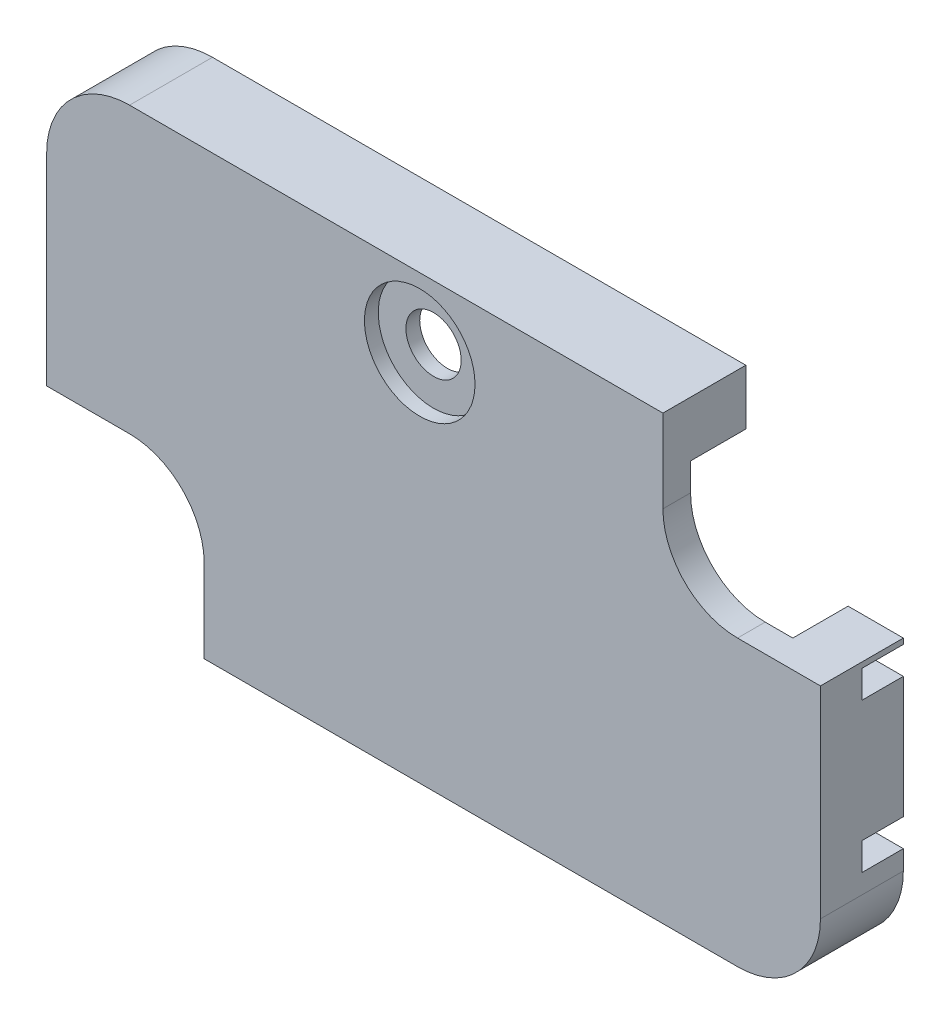
from build123d import *

# Parameters (mm, degrees)
DODANIE_WYCI_GNI_CIE1_DEPTH = 3
WYTNIJ_WYCI_GNI_CIE1_DEPTH  = 2
WYTNIJ_WYCI_GNI_CIE2_REACH  = 31.275
SZKIC3_W                    = 1.5
SZKIC3_H                    = 1
WYTNIJ_WYCI_GNI_CIE3_REACH  = 23.471
SZKIC4_W                    = 1
SZKIC4_H                    = 1.5
SZKIC5_R                    = 2
WYTNIJ_WYCI_GNI_CIE4_DEPTH  = 0.5
WYTNIJ_WYCI_GNI_CIE5_REACH  = 18.317
SZKIC6_R                    = 1


with BuildPart() as part:
    # Szkic1 → Dodanie-wyciągnięcie1 (new body)
    with BuildSketch(Plane.XY):
        with BuildLine():
            Line((-11, 8), (8.3, 8))
            Line((8.3, 8), (8.3, 5))
            ThreePointArc((8.3, 5), (9.090811691, 3.090811691), (11, 2.3))
            Line((11, 2.3), (14, 2.3))
            Line((14, 2.3), (14, -5))
            ThreePointArc((14, -5), (13.121320344, -7.121320344), (11, -8))
            Line((11, -8), (-8.3, -8))
            Line((-8.3, -8), (-8.3, -5))
            ThreePointArc((-8.3, -5), (-9.090811691, -3.090811691), (-11, -2.3))
            Line((-11, -2.3), (-14, -2.3))
            Line((-14, -2.3), (-14, 5))
            ThreePointArc((-14, 5), (-13.121320344, 7.121320344), (-11, 8))
        make_face()
    extrude(amount=DODANIE_WYCI_GNI_CIE1_DEPTH)

    # Szkic2 → Wytnij-wyciągnięcie1 (cut)
    with BuildSketch(Plane(origin=(0, 0, 0), x_dir=(-1, 0, 0), z_dir=(0, 0, -1))):
        with BuildLine():
            Line((11, 7), (-7.3, 7))
            ThreePointArc((-7.3, 7), (-8.007106781, 6.707106781), (-8.3, 6))
            Line((-8.3, 6), (-8.3, 5))
            ThreePointArc((-8.3, 5), (-9.090811691, 3.090811691), (-11, 2.3))
            Line((-11, 2.3), (-12, 2.3))
            ThreePointArc((-12, 2.3), (-12.707106781, 2.007106781), (-13, 1.3))
            Line((-13, 1.3), (-13, -5))
            ThreePointArc((-13, -5), (-12.414213562, -6.414213562), (-11, -7))
            Line((-11, -7), (7.3, -7))
            ThreePointArc((7.3, -7), (8.007106781, -6.707106781), (8.3, -6))
            Line((8.3, -6), (8.3, -5))
            ThreePointArc((8.3, -5), (9.090811691, -3.090811691), (11, -2.3))
            Line((11, -2.3), (12, -2.3))
            ThreePointArc((12, -2.3), (12.707106781, -2.007106781), (13, -1.3))
            Line((13, -1.3), (13, 5))
            ThreePointArc((13, 5), (12.414213562, 6.414213562), (11, 7))
        make_face()
    extrude(amount=-WYTNIJ_WYCI_GNI_CIE1_DEPTH, mode=Mode.SUBTRACT)

    # Szkic3 → Wytnij-wyciągnięcie2 (cut, up to next)
    with BuildSketch(Plane(origin=(14, 0, 0), x_dir=(0, 0, -1), z_dir=(1, 0, 0)), mode=Mode.PRIVATE) as wytnij_wyci_gni_cie2_sk1:
        with Locations((-0.75, 1.6)):
            Rectangle(SZKIC3_W, SZKIC3_H)
    wytnij_wyci_gni_cie2_tool1 = extrude(wytnij_wyci_gni_cie2_sk1.sketch, amount=-WYTNIJ_WYCI_GNI_CIE2_REACH, mode=Mode.PRIVATE) & part.part
    # Szkic3 → Wytnij-wyciągnięcie2 (cut, up to next)
    with BuildSketch(Plane(origin=(14, 0, 0), x_dir=(0, 0, -1), z_dir=(1, 0, 0)), mode=Mode.PRIVATE) as wytnij_wyci_gni_cie2_sk2:
        with Locations((-0.75, -3.8)):
            Rectangle(SZKIC3_W, SZKIC3_H)
    wytnij_wyci_gni_cie2_tool2 = extrude(wytnij_wyci_gni_cie2_sk2.sketch, amount=-WYTNIJ_WYCI_GNI_CIE2_REACH, mode=Mode.PRIVATE) & part.part
    add(wytnij_wyci_gni_cie2_tool1.solids().sort_by_distance((14, 1.6, 0.75))[0], mode=Mode.SUBTRACT)
    add(wytnij_wyci_gni_cie2_tool2.solids().sort_by_distance((14, -3.8, 0.75))[0], mode=Mode.SUBTRACT)

    # Szkic4 → Wytnij-wyciągnięcie3 (cut, up to next)
    with BuildSketch(Plane.XZ.offset(8), mode=Mode.PRIVATE) as wytnij_wyci_gni_cie3_sk1:
        with Locations((2, 0.75)):
            Rectangle(SZKIC4_W, SZKIC4_H)
    wytnij_wyci_gni_cie3_tool1 = extrude(wytnij_wyci_gni_cie3_sk1.sketch, amount=-WYTNIJ_WYCI_GNI_CIE3_REACH, mode=Mode.PRIVATE) & part.part
    add(wytnij_wyci_gni_cie3_tool1.solids().sort_by_distance((2, -8, 0.75))[0], mode=Mode.SUBTRACT)

    # Szkic5 → Wytnij-wyciągnięcie4 (cut)
    with BuildSketch(Plane.XY.offset(3)):
        with Locations((-0.5, 5.5)):
            Circle(SZKIC5_R)
    extrude(amount=-WYTNIJ_WYCI_GNI_CIE4_DEPTH, mode=Mode.SUBTRACT)

    # Szkic6 → Wytnij-wyciągnięcie5 (cut, up to next)
    with BuildSketch(Plane.XY.offset(2.5), mode=Mode.PRIVATE) as wytnij_wyci_gni_cie5_sk1:
        with Locations((-0.5, 5.5)):
            Circle(SZKIC6_R)
    wytnij_wyci_gni_cie5_tool1 = extrude(wytnij_wyci_gni_cie5_sk1.sketch, amount=-WYTNIJ_WYCI_GNI_CIE5_REACH, mode=Mode.PRIVATE) & part.part
    add(wytnij_wyci_gni_cie5_tool1.solids().sort_by_distance((-0.5, 5.5, 2.5))[0], mode=Mode.SUBTRACT)


solid = part.part
